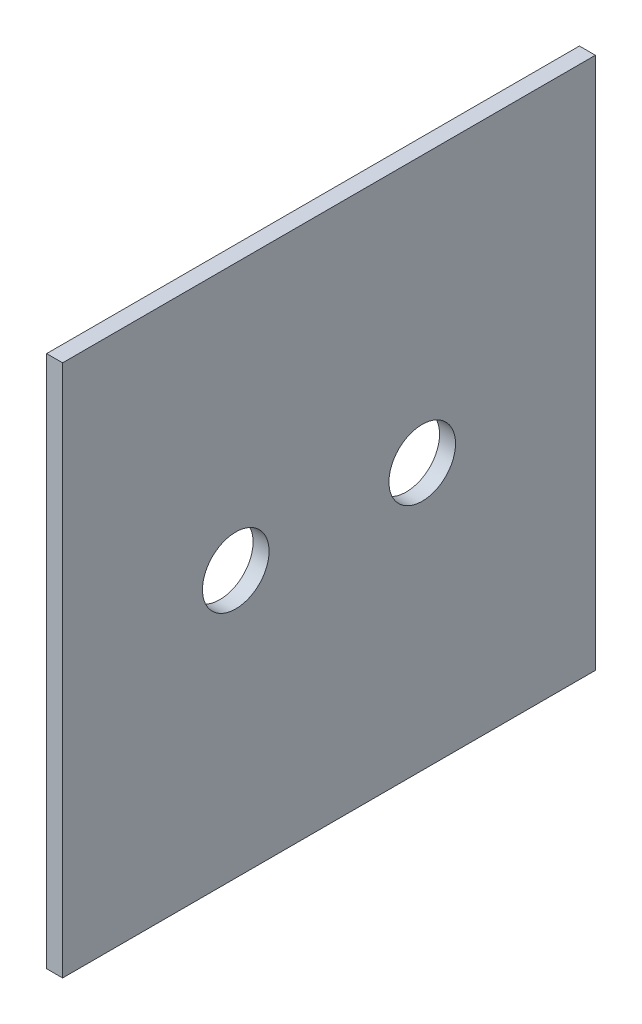
from build123d import *

# Parameters (mm, degrees)
SKETCH1_W           = 200
SKETCH1_H           = 200
SKETCH1_R           = 12.5
BOSS_EXTRUDE1_DEPTH = 6


with BuildPart() as part:
    # Sketch1 → Boss-Extrude1 (new body)
    with BuildSketch(Plane(origin=(0, 0, 0), x_dir=(0, 0, -1), z_dir=(1, 0, 0))):
        with Locations((7.282608696, 33.45923913)):
            Rectangle(SKETCH1_W, SKETCH1_H)
        with Locations((42.282608696, 33.45923913)):
            Circle(SKETCH1_R, mode=Mode.SUBTRACT)
        with Locations((-27.717391304, 33.45923913)):
            Circle(SKETCH1_R, mode=Mode.SUBTRACT)
    extrude(amount=BOSS_EXTRUDE1_DEPTH)


solid = part.part
